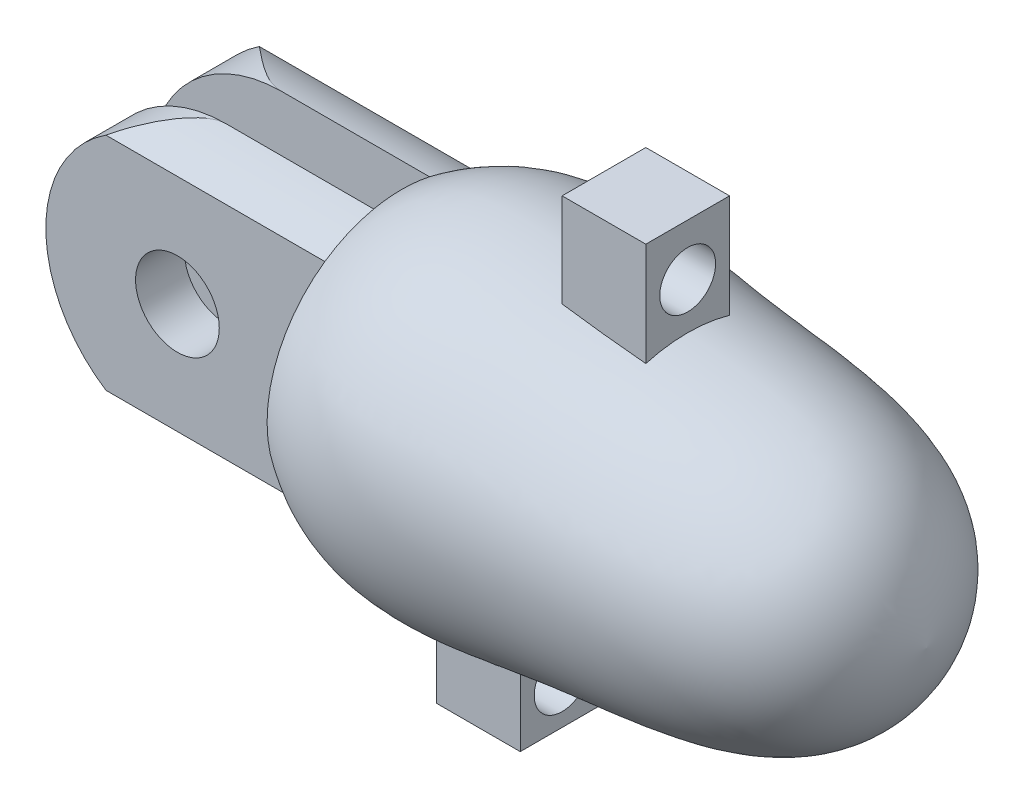
from build123d import *

# Parameters (mm, degrees)
SKETCH2_W               = 11
SKETCH2_H               = 20
BOSS_EXTRUDE1_DEPTH     = 20
SKETCH3_R               = 15
SKETCH3_R_2             = 9.642090149
CUT_EXTRUDE1_DEPTH      = 42.372377867
CUT_EXTRUDE2_DEPTH      = 42.267785166
CUT_EXTRUDE2_DEPTH_BACK = 42.267785166
SKETCH4_W               = 20
SKETCH4_H               = 4
CUT_EXTRUDE3_DEPTH      = 42.901456055
CUT_EXTRUDE3_DEPTH_BACK = 42.901456055
SKETCH7_R               = 3
CUT_EXTRUDE4_DEPTH      = 44.211230012
SKETCH10_W              = 6
SKETCH10_H              = 6
BOSS_EXTRUDE3_DEPTH     = 18
SKETCH11_R              = 2
CUT_EXTRUDE6_DEPTH      = 39.271928202
SKETCH8_W               = 6
SKETCH8_H               = 6
BOSS_EXTRUDE4_DEPTH     = 18
SKETCH12_R              = 2
CUT_EXTRUDE7_DEPTH      = 46.965327997
SCALE1_SCALE            = 0.75


with BuildPart() as part:
    # Sketch1 → Revolve1 (revolve)
    with BuildSketch(Plane.XY):
        with BuildLine():
            Line((-17.503938211, 9.642090149), (-17.503938211, 0))
            Line((-17.503938211, 0), (20.115058741, 0))
            add(Edge.make_bspline(
                [(-17.503938211, 9.642090149), (-12.037965172, 13.468024809), (1.720669261, 9.986942396), (18.674857326, 10.7604322), (20.115058741, 0)],
                knots=[0, 0, 0, 0, 0.417251545, 1, 1, 1, 1], degree=3))
        make_face()
    revolve(axis=Axis((-34.275157211, 0, 0), (1, 0, 0)))

    # Sketch2 → Boss-Extrude1 (add)
    with BuildSketch(Plane.ZY.offset(17.503938211)):
        Rectangle(SKETCH2_W, SKETCH2_H)
    extrude(amount=BOSS_EXTRUDE1_DEPTH)

    # Sketch3 → Cut-Extrude1 (cut, through all)
    with BuildSketch(Plane.ZY.offset(17.503938211)):
        Circle(SKETCH3_R)
        Circle(SKETCH3_R_2, mode=Mode.SUBTRACT)
    extrude(amount=CUT_EXTRUDE1_DEPTH, mode=Mode.SUBTRACT)

    # Sketch4 → Cut-Extrude2 (cut, two sides: drawn at the far end of the back side and taken through both)
    with BuildSketch(Plane(origin=(0, 0, 0), x_dir=(1, 0, 0), z_dir=(0, 1, 0)).offset(-CUT_EXTRUDE2_DEPTH_BACK)):
        with Locations((-27.503938211, 0)):
            Rectangle(SKETCH4_W, SKETCH4_H)
    extrude(amount=CUT_EXTRUDE2_DEPTH + CUT_EXTRUDE2_DEPTH_BACK, mode=Mode.SUBTRACT)

    # Sketch6 → Cut-Extrude3 (cut, two sides: drawn at the far end of the back side and taken through both)
    with BuildSketch(Plane.XY.offset(-2).offset(-CUT_EXTRUDE3_DEPTH_BACK)):
        with BuildLine():
            Line((-37.503938211, -9.43238583), (-28.071552381, -9.43238583))
            ThreePointArc((-28.071552381, -9.43238583), (-34.741256364, -6.669703983), (-37.503938211, 0))
            Line((-37.503938211, 0), (-37.503938211, -9.43238583))
        make_face()
        with BuildLine():
            Line((-37.503938211, 9.43238583), (-37.503938211, 0))
            ThreePointArc((-37.503938211, 0), (-34.741256364, 6.669703983), (-28.071552381, 9.43238583))
            Line((-28.071552381, 9.43238583), (-37.503938211, 9.43238583))
        make_face()
    extrude(amount=CUT_EXTRUDE3_DEPTH + CUT_EXTRUDE3_DEPTH_BACK, mode=Mode.SUBTRACT)

    # Sketch7 → Cut-Extrude4 (cut, through all)
    with BuildSketch(Plane.XY.offset(5.5)):
        with Locations((-28.071552381, 0)):
            Circle(SKETCH7_R)
    extrude(amount=-CUT_EXTRUDE4_DEPTH, mode=Mode.SUBTRACT)

    # Sketch10 → Boss-Extrude3 (add)
    with BuildSketch(Plane(origin=(0, 0, 0), x_dir=(1, 0, 0), z_dir=(0, 1, 0))):
        with Locations((-9, 0)):
            Rectangle(SKETCH10_W, SKETCH10_H)
    extrude(amount=-BOSS_EXTRUDE3_DEPTH)

    # Sketch11 → Cut-Extrude6 (cut, through all)
    with BuildSketch(Plane(origin=(-6, 0, 0), x_dir=(0, 0, -1), z_dir=(1, 0, 0))):
        with Locations((0, -15.01416918)):
            Circle(SKETCH11_R)
    extrude(amount=-CUT_EXTRUDE6_DEPTH, mode=Mode.SUBTRACT)

    # Sketch8 → Boss-Extrude4 (add)
    with BuildSketch(Plane(origin=(0, 0, 0), x_dir=(1, 0, 0), z_dir=(0, 1, 0))):
        Rectangle(SKETCH8_W, SKETCH8_H)
    extrude(amount=BOSS_EXTRUDE4_DEPTH)

    # Sketch12 → Cut-Extrude7 (cut, through all)
    with BuildSketch(Plane(origin=(3, 0, 0), x_dir=(0, 0, -1), z_dir=(1, 0, 0))):
        with Locations((0, 14.293955788)):
            Circle(SKETCH12_R)
    extrude(amount=-CUT_EXTRUDE7_DEPTH, mode=Mode.SUBTRACT)


with BuildPart() as part_1:
    # Scale1: scaled about (-4.862736276, 0.025056195, 1.7e-08)
    add(part.part.scale(SCALE1_SCALE).moved(Location((-1.215684069, 0.006264049, 4e-09))))


solid = part_1.part
